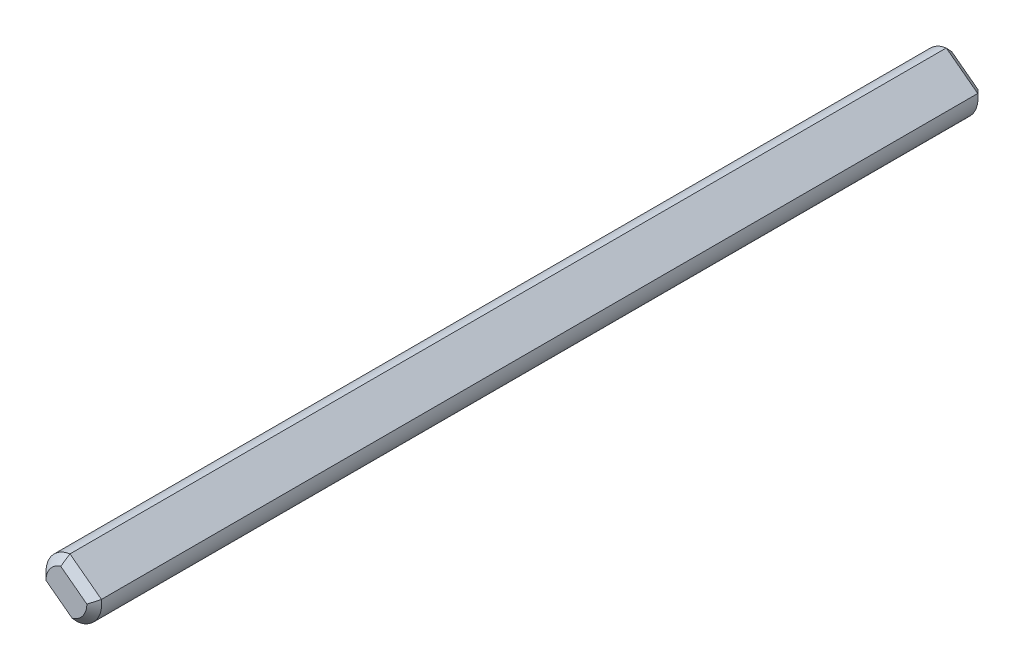
from build123d import *

# Parameters (mm, degrees)
BOSS_EXTRUDE1_DEPTH = 120
END_SIZE            = 1


with BuildPart() as part:
    # Sketch1 → Boss-Extrude1 (new body)
    with BuildSketch(Plane.XY):
        with BuildLine():
            Line((-16.18058706286363, 3.583270500183823), (-20.41674499500726, 6.773876394671033))
            ThreePointArc((-20.41674499500726, 6.773876394671035), (-22.889384976175005, 5.316593545441291), (-23.607350889494484, 2.5377184625273967))
            Line((-23.607350889494484, 2.5377184625273967), (-19.371192957350857, -0.6528874319598208))
            ThreePointArc((-19.371192957350857, -0.6528874319598175), (-17.06351759251198, 0.6006072959958577), (-16.14396897617906, 3.0604944813556076))
            ThreePointArc((-16.14396897617906, 3.0604944813556085), (-16.153134699247452, 3.3225229388436817), (-16.180587062863637, 3.583270500183822))
        make_face()
    extrude(amount=BOSS_EXTRUDE1_DEPTH)

    # End
    end_edges = [part.edges().sort_by_distance(p)[0] for p in [
        (-22.889384976175005, 5.316593545441292, 120),
        (-16.89855297618315, 0.8043954172700718, 120),
        (-18.298666028935443, 5.1785734474274285, 120),
        (-16.898552976183115, 0.8043954172699284, 0),
        (-22.889384976175005, 5.316593545441292, 0),
        (-18.298666028935443, 5.1785734474274285, 0),
        (-21.48927192342267, 0.9424155152837879, 120),
        (-21.48927192342267, 0.9424155152837879, 0),
    ]]
    chamfer(end_edges, length=END_SIZE)


solid = part.part
